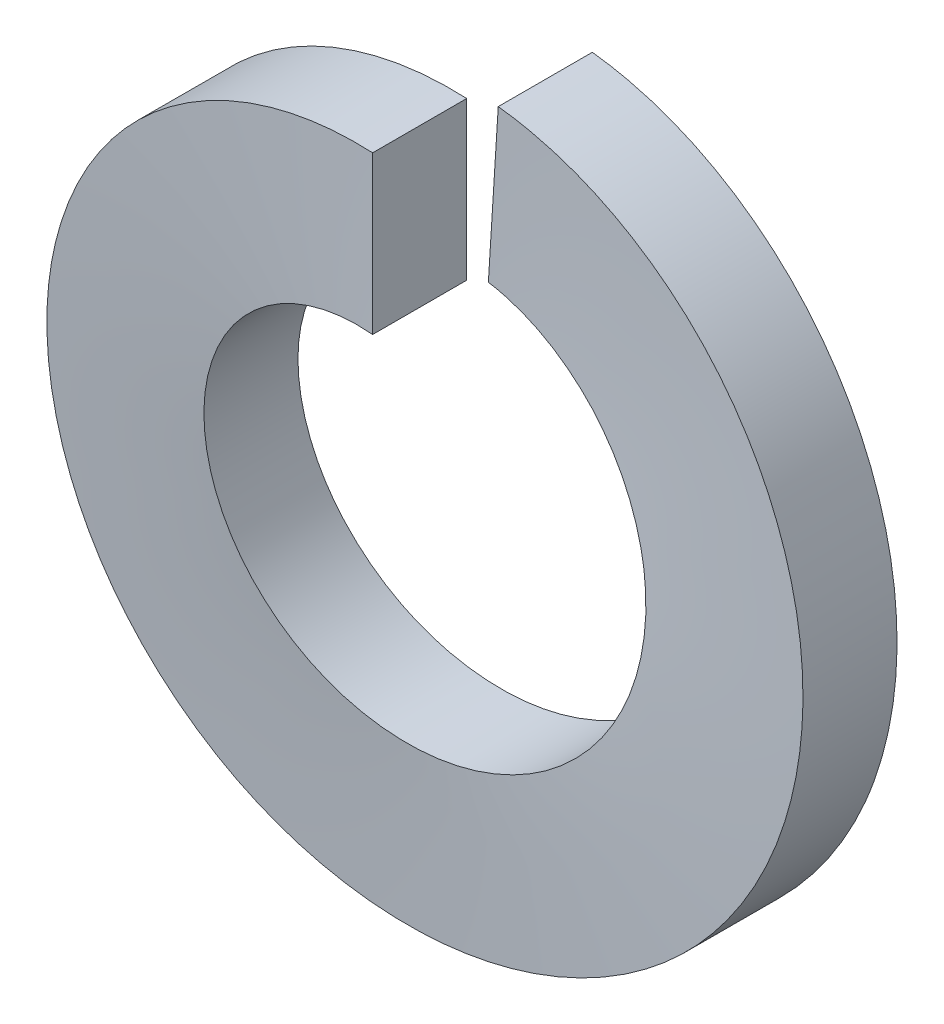
from build123d import *

# Parameters (mm, degrees)
SWEEP1_PITCH       = 2.201333333
SWEEP1_HEIGHT      = 2.17932
SWEEP1_RADIUS      = 7.4041
SWEEP1_START_ANGLE = 90
SKETCH2_W          = 1.9812
SKETCH2_H          = 3.3147


with BuildPart() as part:
    # Sweep1: sweep along a helix
    with BuildLine() as sweep1_path:
        add(Helix(SWEEP1_PITCH, SWEEP1_HEIGHT, SWEEP1_RADIUS, center=(0, 0, 0), direction=(0, 0, -1), lefthand=True, mode=Mode.PRIVATE).rotate(Axis((0, 0, 0), (0, 0, -1)), SWEEP1_START_ANGLE))
    # Sketch2 → Sweep1 (sweep)
    with BuildSketch(Plane(origin=(0, 0, 0), x_dir=(0, 0, -1), z_dir=(1, 0, 0))):
        with Locations((-0.9906, 5.74675)):
            Rectangle(SKETCH2_W, SKETCH2_H)
    sweep(path=sweep1_path.line, is_frenet=True)


solid = part.part
